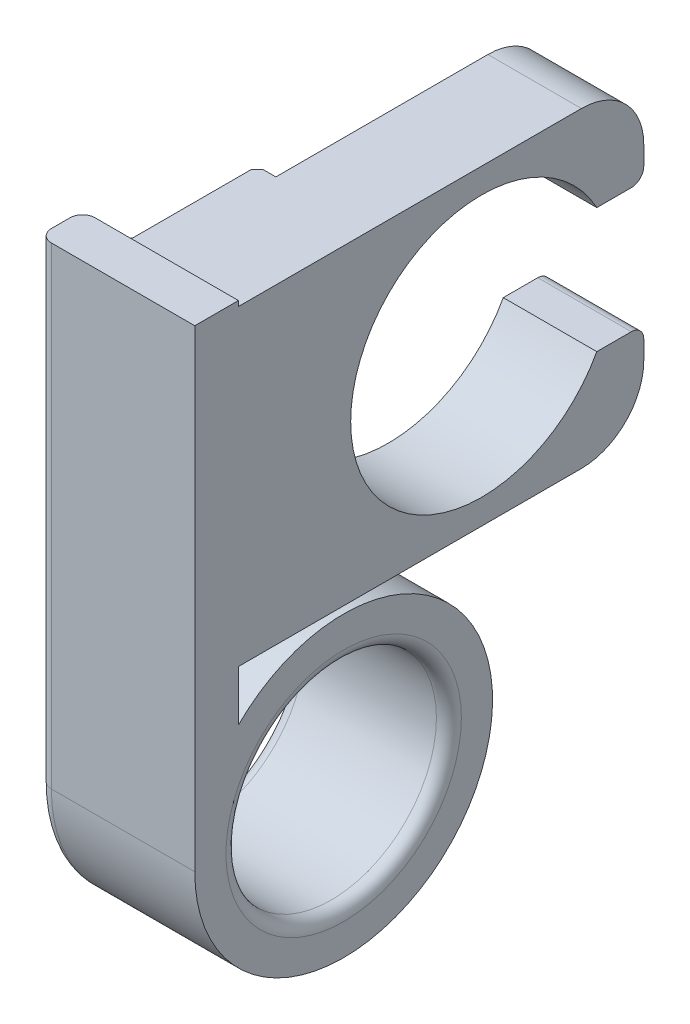
from build123d import *

# Parameters (mm, degrees)
SKETCH1_R           = 23.875
SKETCH1_R_2         = 16.875
BOSS_EXTRUDE1_DEPTH = 25
SKETCH2_W           = 25
SKETCH2_H           = 7
BOSS_EXTRUDE2_DEPTH = 75.83
BOSS_EXTRUDE3_DEPTH = 15
FILLET1_R           = 10
FILLET2_R           = 2
FILLET3_R           = 2
SKETCH5_W           = 21
SKETCH5_H           = 50
BOSS_EXTRUDE4_DEPTH = 3
CHAMFER1_SIZE       = 1


with BuildPart() as part:
    # Sketch1 → Boss-Extrude1 (new body)
    with BuildSketch(Plane(origin=(0, 0, 0), x_dir=(0, 0, -1), z_dir=(1, 0, 0))):
        Circle(SKETCH1_R)
        Circle(SKETCH1_R_2, mode=Mode.SUBTRACT)
    extrude(amount=BOSS_EXTRUDE1_DEPTH)

    # Sketch2 → Boss-Extrude2 (add)
    with BuildSketch(Plane(origin=(0, 0, 0), x_dir=(1, 0, 0), z_dir=(0, 1, 0))):
        with Locations((12.5, -20.375)):
            Rectangle(SKETCH2_W, SKETCH2_H)
    extrude(amount=BOSS_EXTRUDE2_DEPTH)

    # Sketch4 → Boss-Extrude3 (add)
    with BuildSketch(Plane.ZY.offset(-25)):
        with BuildLine():
            Line((-40.591185313, 40), (-48.125, 40))
            Line((-48.125, 40), (-48.125, 25))
            Line((-48.125, 25), (23.875, 25))
            Line((23.875, 25), (23.875, 75))
            Line((23.875, 75), (-48.125, 75))
            Line((-48.125, 75), (-48.125, 60))
            Line((-48.125, 60), (-40.591185313, 60))
            ThreePointArc((-40.591185313, 60), (-1.125, 50), (-40.591185313, 40))
        make_face()
    extrude(amount=BOSS_EXTRUDE3_DEPTH)

    # Fillet1
    fillet1_edges = [part.edges().sort_by_distance(p)[0] for p in [
        (17.5, 75, -48.125),
        (17.5, 25, -48.125),
    ]]
    fillet(fillet1_edges, radius=FILLET1_R)

    # Fillet2
    fillet2_edges = [part.edges().sort_by_distance(p)[0] for p in [
        (0, -9.141252649, -22.055682374),
        (0, 46.359672877, 16.875),
        (0, 37.915, 23.875),
        (0, 0, 16.875),
        (25, 0, 16.875),
    ]]
    fillet(fillet2_edges, radius=FILLET2_R)

    # Fillet3
    fillet3_edges = [part.edges().sort_by_distance(p)[0] for p in [
        (17.5, 60, -48.125),
        (17.5, 40, -48.125),
    ]]
    fillet(fillet3_edges, radius=FILLET3_R)

    # Sketch5 → Boss-Extrude4 (add)
    with BuildSketch(Plane.ZY.offset(-10)):
        with Locations((6.375, 50)):
            Rectangle(SKETCH5_W, SKETCH5_H)
    extrude(amount=BOSS_EXTRUDE4_DEPTH)

    # Chamfer1
    chamfer1_edges = [part.edges().sort_by_distance(p)[0] for p in [
        (7, 50, 16.875),
        (7, 50, -4.125),
    ]]
    chamfer(chamfer1_edges, length=CHAMFER1_SIZE)


solid = part.part
